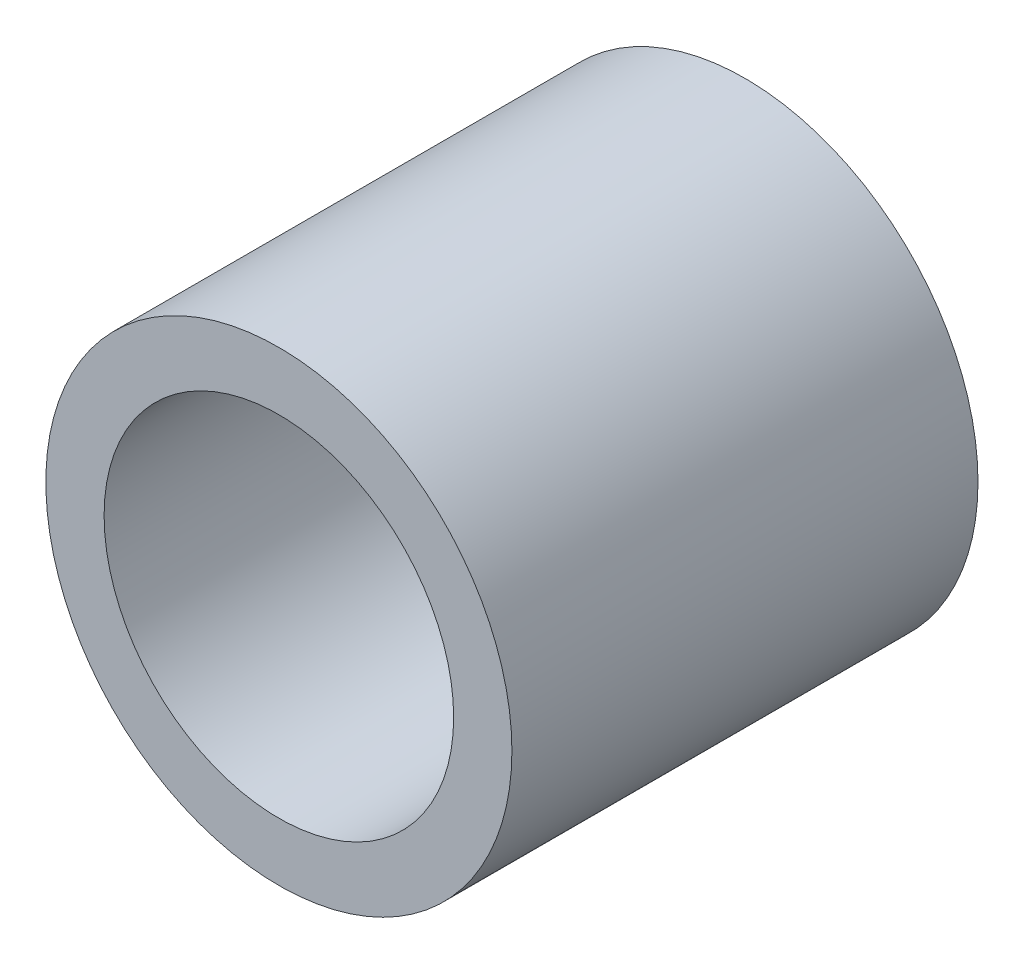
from build123d import *

# Parameters (mm, degrees)
SKETCH_1_R      = 4
SKETCH_1_R_2    = 3
EXTRUDE_1_DEPTH = 8


with BuildPart() as part:
    # 草图1 → 凸台-拉伸1 (new body)
    with BuildSketch(Plane.XY):
        Circle(SKETCH_1_R)
        Circle(SKETCH_1_R_2, mode=Mode.SUBTRACT)
    extrude(amount=EXTRUDE_1_DEPTH)


solid = part.part
